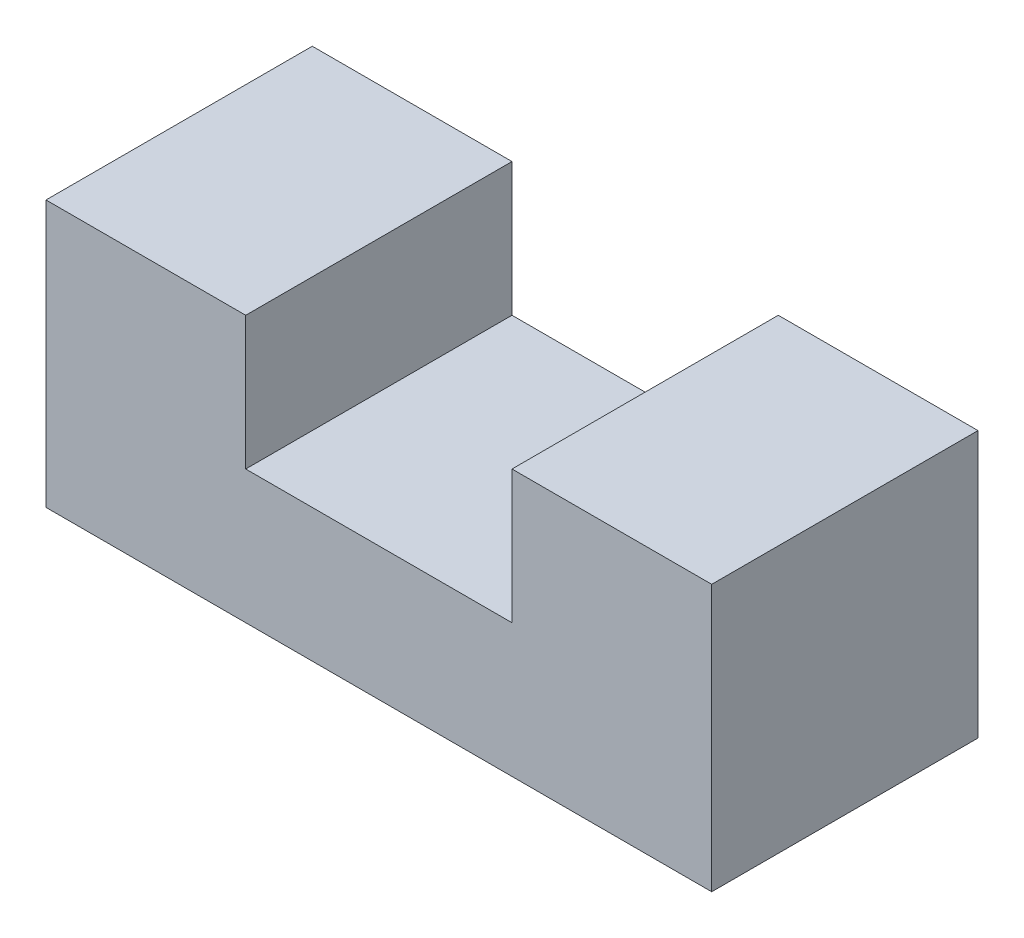
from build123d import *

# Parameters (mm, degrees)
EXTRUDE_1_DEPTH = 20


with BuildPart() as part:
    # 草圖1 → 填料-伸長1 (new body)
    with BuildSketch(Plane.XY):
        Polygon((-10, 10), (-25, 10), (-25, -10), (25, -10), (25, 10), (10, 10), (10, 0), (-10, 0), align=None)
    extrude(amount=EXTRUDE_1_DEPTH)


solid = part.part
